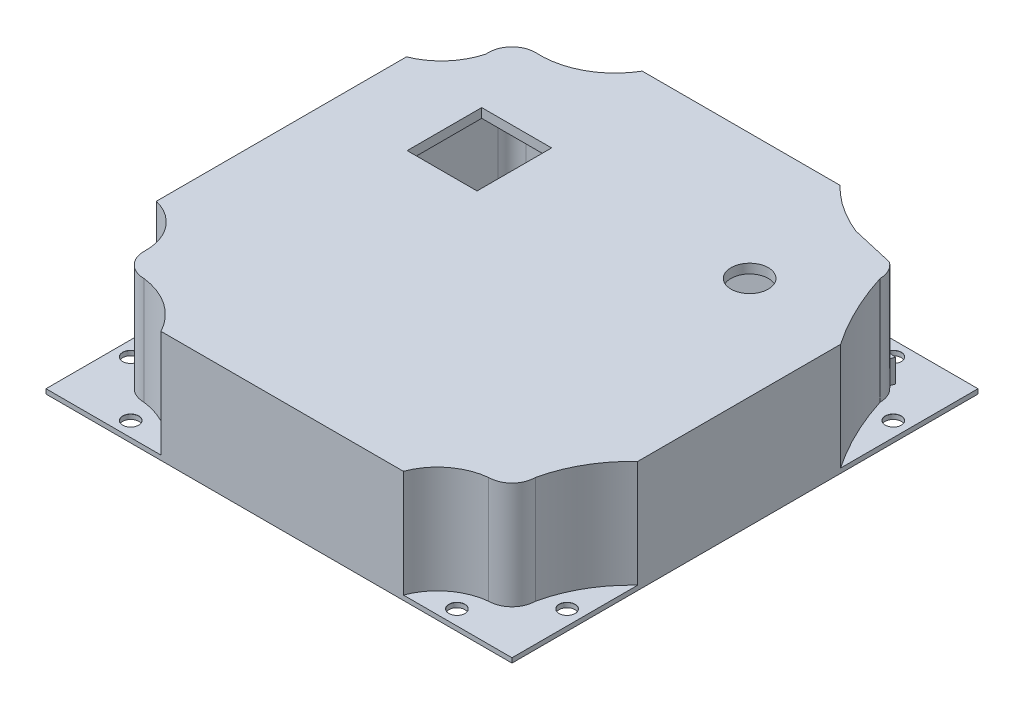
from build123d import *

# Parameters (mm, degrees)
SKETCH1_W                      = 100
SKETCH1_H                      = 100
BOSS_EXTRUDE3_DEPTH            = 6.35
M3_CLEARANCE_HOLE1_D           = 3.4
M3_CLEARANCE_HOLE1_CSINK_D     = 3.45
M3_CLEARANCE_HOLE1_CSINK_ANGLE = 90
CUT_EXTRUDE1_DEPTH             = 10
SKETCH20_R                     = 1.6
BOSS_EXTRUDE4_DEPTH            = 5
BOSS_EXTRUDE5_START            = 5
SKETCH21_W                     = 9.2
SKETCH21_H                     = 5.055773539
BOSS_EXTRUDE5_DEPTH            = 5
BOSS_EXTRUDE6_START            = 21
SKETCH21_3_W                   = 9.2
SKETCH21_3_H                   = 5.055773539
BOSS_EXTRUDE6_DEPTH            = 16
BOSS_EXTRUDE7_START            = 2
SKETCH22_R                     = 4
SKETCH22_W                     = 15
SKETCH22_H                     = 16
BOSS_EXTRUDE7_DEPTH            = 2
SKETCH24_W                     = 100
SKETCH24_H                     = 100
SKETCH24_R                     = 1.7
CUT_EXTRUDE2_DEPTH             = 5.35
CUT_EXTRUDE3_DEPTH             = 5


with BuildPart() as part:
    # Sketch1 → Boss-Extrude3 (new body)
    with BuildSketch(Plane(origin=(0, 0, 0), x_dir=(1, 0, 0), z_dir=(0, 1, 0))):
        Rectangle(SKETCH1_W, SKETCH1_H)
    extrude(amount=BOSS_EXTRUDE3_DEPTH)

    # M3 Clearance Hole1 (through all)
    with Locations(Plane(origin=(0, 6.35, 0), x_dir=(1, 0, 0), z_dir=(0, 1, 0))):
        with Locations((-46.825, 35), (-35, 46.825), (35, 46.825), (46.825, 35), (46.825, -35), (35, -46.825), (-35, -46.825), (-46.825, -35)):
            CounterSinkHole(M3_CLEARANCE_HOLE1_D / 2, M3_CLEARANCE_HOLE1_CSINK_D / 2, counter_sink_angle=M3_CLEARANCE_HOLE1_CSINK_ANGLE)

    # Sketch19 → Cut-Extrude1 (cut)
    with BuildSketch(Plane(origin=(0, 6.35, 0), x_dir=(1, 0, 0), z_dir=(0, 1, 0))):
        with BuildLine():
            Line((-37, -40), (37, -40))
            ThreePointArc((37, -40), (39.121320344, -39.121320344), (40, -37))
            Line((40, -37), (40, 37))
            ThreePointArc((40, 37), (39.121320344, 39.121320344), (37, 40))
            Line((37, 40), (-37, 40))
            ThreePointArc((-37, 40), (-39.121320344, 39.121320344), (-40, 37))
            Line((-40, 37), (-40, -37))
            ThreePointArc((-40, -37), (-39.121320344, -39.121320344), (-37, -40))
        make_face()
    extrude(amount=-CUT_EXTRUDE1_DEPTH, mode=Mode.SUBTRACT)

    # Sketch20 → Boss-Extrude4 (add)
    # profile 1 of 2: a face of its own
    with BuildSketch(Plane(origin=(0, 6.35, -6.35), x_dir=(1, 0, 0), z_dir=(0, -1, 0))):
        with BuildLine():
            Line((1.60040755, 36.488159347), (1.60040755, 46.35))
            Line((1.60040755, 46.35), (1.60040755, 51.405773539))
            Line((1.60040755, 51.405773539), (10.80040755, 51.405773539))
            Line((10.80040755, 51.405773539), (10.80040755, 46.35))
            Line((10.80040755, 46.35), (10.80040755, 36.488159347))
            ThreePointArc((10.80040755, 36.488159347), (6.20040755, 31.888159347), (1.60040755, 36.488159347))
        make_face()
        with Locations(Location((6.20040755, 36.488159347, 0), (0, 0, 90))):
            Circle(SKETCH20_R, mode=Mode.SUBTRACT)
    # profile 2 of 2: a face of its own
    with BuildSketch(Plane(origin=(0, 6.35, -6.35), x_dir=(1, 0, 0), z_dir=(0, -1, 0))):
        with BuildLine():
            Line((23.839549451, -18.252155571), (39.121320344, -32.771320344))
            Line((39.121320344, -32.771320344), (40.293422294, -35.621786908))
            Line((40.293422294, -35.621786908), (30.564708642, -36.851704553))
            Line((30.564708642, -36.851704553), (26.695067206, -33.65))
            Line((26.695067206, -33.65), (17.503754806, -24.92281552))
            ThreePointArc((17.503754806, -24.92281552), (17.335801876, -18.419094063), (23.839549451, -18.252155571))
        make_face()
        with Locations(Location((20.671131891, -21.586991424, 0), (0, 0, 90))):
            Circle(SKETCH20_R, mode=Mode.SUBTRACT)
    extrude(amount=-BOSS_EXTRUDE4_DEPTH)

    # Sketch21 → Boss-Extrude5 (add)
    with BuildSketch(Plane(origin=(0, 6.35, 0), x_dir=(1, 0, 0), z_dir=(0, 1, 0)).offset(BOSS_EXTRUDE5_START)):
        with BuildLine():
            Line((40, 37), (40, -37))
            ThreePointArc((40, -37), (39.121320344, -39.121320344), (37, -40))
            Line((37, -40), (10.80040755, -40))
            Line((10.80040755, -40), (10.80040755, -45.055773539))
            Line((10.80040755, -45.055773539), (1.60040755, -45.055773539))
            Line((1.60040755, -45.055773539), (1.60040755, -40))
            Line((1.60040755, -40), (-37, -40))
            ThreePointArc((-37, -40), (-39.121320344, -39.121320344), (-40, -37))
            Line((-40, -37), (-40, 37))
            ThreePointArc((-40, 37), (-39.121320344, 39.121320344), (-37, 40))
            Line((-37, 40), (26.695067206, 40))
            Line((26.695067206, 40), (30.564708642, 43.201704553))
            ThreePointArc((30.564708642, 43.201704553), (25.113568567, 46.068744386), (20.37225284, 50))
            Line((20.37225284, 50), (-22.050029616, 50))
            ThreePointArc((-22.050029616, 50), (-27.54753826, 44.370089204), (-35.050949086, 42))
            ThreePointArc((-35.050949086, 42), (-36.025474543, 41.970620085), (-37, 42))
            ThreePointArc((-37, 42), (-40.535533906, 40.535533906), (-42, 37))
            Line((-42, 37), (-42, 36.335199984))
            ThreePointArc((-42, 36.335199984), (-44.947236911, 30.903309262), (-50, 27.345047411))
            Line((-50, 27.345047411), (-50, -26.314925762))
            ThreePointArc((-50, -26.314925762), (-44.357013872, -29.919194986), (-42, -36.186453931))
            ThreePointArc((-42, -36.186453931), (-41.99219234, -36.593226965), (-42, -37))
            ThreePointArc((-42, -37), (-40.535533906, -40.535533906), (-37, -42))
            ThreePointArc((-37, -42), (-30.181405564, -44.566583152), (-25.327689408, -50))
            Line((-25.327689408, -50), (26.695067206, -50))
            ThreePointArc((26.695067206, -50), (30.712297628, -44.537683696), (37, -42))
            ThreePointArc((37, -42), (40.535533906, -40.535533906), (42, -37))
            ThreePointArc((42, -37), (44.938337838, -29.41034973), (50, -23.037265969))
            Line((50, -23.037265969), (50, 20.508785558))
            ThreePointArc((50, 20.508785558), (45.396228517, 28.461499137), (42, 37))
            ThreePointArc((42, 37), (41.449283771, 39.281200107), (39.918450428, 41.059882646))
            Line((39.918450428, 41.059882646), (39.121320344, 39.121320344))
            ThreePointArc((39.121320344, 39.121320344), (39.771638598, 38.148050297), (40, 37))
        make_face()
        Polygon((26.695067206, 40), (39.121320344, 39.121320344), (39.918450428, 41.059882646), (30.564708642, 43.201704553), align=None)
        with Locations((6.20040755, -42.52788677)):
            Rectangle(SKETCH21_W, SKETCH21_H)
    extrude(amount=-BOSS_EXTRUDE5_DEPTH)

    # Sketch21<3> → Boss-Extrude6 (add)
    with BuildSketch(Plane(origin=(0, 6.35, 0), x_dir=(1, 0, 0), z_dir=(0, 1, 0)).offset(BOSS_EXTRUDE6_START)):
        with BuildLine():
            Line((40, 37), (40, -37))
            ThreePointArc((40, -37), (39.121320344, -39.121320344), (37, -40))
            Line((37, -40), (10.80040755, -40))
            Line((10.80040755, -40), (10.80040755, -45.055773539))
            Line((10.80040755, -45.055773539), (1.60040755, -45.055773539))
            Line((1.60040755, -45.055773539), (1.60040755, -40))
            Line((1.60040755, -40), (-37, -40))
            ThreePointArc((-37, -40), (-39.121320344, -39.121320344), (-40, -37))
            Line((-40, -37), (-40, 37))
            ThreePointArc((-40, 37), (-39.121320344, 39.121320344), (-37, 40))
            Line((-37, 40), (26.695067206, 40))
            Line((26.695067206, 40), (30.564708642, 43.201704553))
            ThreePointArc((30.564708642, 43.201704553), (25.113568567, 46.068744386), (20.37225284, 50))
            Line((20.37225284, 50), (-22.050029616, 50))
            ThreePointArc((-22.050029616, 50), (-27.54753826, 44.370089204), (-35.050949086, 42))
            ThreePointArc((-35.050949086, 42), (-36.025474543, 41.970620085), (-37, 42))
            ThreePointArc((-37, 42), (-40.535533906, 40.535533906), (-42, 37))
            Line((-42, 37), (-42, 36.335199984))
            ThreePointArc((-42, 36.335199984), (-44.947236911, 30.903309262), (-50, 27.345047411))
            Line((-50, 27.345047411), (-50, -26.314925762))
            ThreePointArc((-50, -26.314925762), (-44.357013872, -29.919194986), (-42, -36.186453931))
            ThreePointArc((-42, -36.186453931), (-41.99219234, -36.593226965), (-42, -37))
            ThreePointArc((-42, -37), (-40.535533906, -40.535533906), (-37, -42))
            ThreePointArc((-37, -42), (-30.181405564, -44.566583152), (-25.327689408, -50))
            Line((-25.327689408, -50), (26.695067206, -50))
            ThreePointArc((26.695067206, -50), (30.712297628, -44.537683696), (37, -42))
            ThreePointArc((37, -42), (40.535533906, -40.535533906), (42, -37))
            ThreePointArc((42, -37), (44.938337838, -29.41034973), (50, -23.037265969))
            Line((50, -23.037265969), (50, 20.508785558))
            ThreePointArc((50, 20.508785558), (45.396228517, 28.461499137), (42, 37))
            ThreePointArc((42, 37), (41.449283771, 39.281200107), (39.918450428, 41.059882646))
            Line((39.918450428, 41.059882646), (39.121320344, 39.121320344))
            ThreePointArc((39.121320344, 39.121320344), (39.771638598, 38.148050297), (40, 37))
        make_face()
        Polygon((26.695067206, 40), (39.121320344, 39.121320344), (39.918450428, 41.059882646), (30.564708642, 43.201704553), align=None)
        with Locations((6.20040755, -42.52788677)):
            Rectangle(SKETCH21_3_W, SKETCH21_3_H)
    extrude(amount=-BOSS_EXTRUDE6_DEPTH)

    # Sketch22 → Boss-Extrude7 (add)
    with BuildSketch(Plane(origin=(0, 27.35, 0), x_dir=(1, 0, 0), z_dir=(0, 1, 0)).offset(BOSS_EXTRUDE7_START)):
        with BuildLine():
            Line((-42, 37), (-42, 36.335199984))
            ThreePointArc((-42, 36.335199984), (-44.947236911, 30.903309262), (-50, 27.345047411))
            Line((-50, 27.345047411), (-50, -26.314925762))
            ThreePointArc((-50, -26.314925762), (-44.106969392, -30.24013582), (-42, -37))
            ThreePointArc((-42, -37), (-40.535533906, -40.535533906), (-37, -42))
            ThreePointArc((-37, -42), (-30.181405564, -44.566583152), (-25.327689408, -50))
            Line((-25.327689408, -50), (26.695067206, -50))
            ThreePointArc((26.695067206, -50), (30.712297628, -44.537683696), (37, -42))
            ThreePointArc((37, -42), (40.535533906, -40.535533906), (42, -37))
            ThreePointArc((42, -37), (44.938337838, -29.41034973), (50, -23.037265969))
            Line((50, -23.037265969), (50, 20.508785558))
            ThreePointArc((50, 20.508785558), (45.396228517, 28.461499137), (42, 37))
            ThreePointArc((42, 37), (41.449283771, 39.281200107), (39.918450428, 41.059882646))
            Line((39.918450428, 41.059882646), (30.564708642, 43.201704553))
            ThreePointArc((30.564708642, 43.201704553), (25.113568567, 46.068744386), (20.37225284, 50))
            Line((20.37225284, 50), (-22.050029616, 50))
            ThreePointArc((-22.050029616, 50), (-28.392914241, 43.884391256), (-37, 42))
            ThreePointArc((-37, 42), (-40.535533906, 40.535533906), (-42, 37))
        make_face()
        with Locations(Location((28, 23, 0), (0, 0, 270))):
            Circle(SKETCH22_R, mode=Mode.SUBTRACT)
        with Locations((-25, 18)):
            Rectangle(SKETCH22_W, SKETCH22_H, mode=Mode.SUBTRACT)
    extrude(amount=-BOSS_EXTRUDE7_DEPTH)

    # Sketch24 → Cut-Extrude2 (cut)
    with BuildSketch(Plane.XZ):
        Rectangle(SKETCH24_W, SKETCH24_H)
        with Locations(Location((-46.825, -35, 0), (0, 0, 90))):
            Circle(SKETCH24_R, mode=Mode.SUBTRACT)
        with Locations(Location((-35, -46.825, 0), (0, 0, 90))):
            Circle(SKETCH24_R, mode=Mode.SUBTRACT)
        with Locations(Location((35, -46.825, 0), (0, 0, 90))):
            Circle(SKETCH24_R, mode=Mode.SUBTRACT)
        with Locations(Location((46.825, -35, 0), (0, 0, 90))):
            Circle(SKETCH24_R, mode=Mode.SUBTRACT)
        with Locations(Location((46.825, 35, 0), (0, 0, 90))):
            Circle(SKETCH24_R, mode=Mode.SUBTRACT)
        with Locations(Location((35, 46.825, 0), (0, 0, 90))):
            Circle(SKETCH24_R, mode=Mode.SUBTRACT)
        with Locations(Location((-35, 46.825, 0), (0, 0, 90))):
            Circle(SKETCH24_R, mode=Mode.SUBTRACT)
        with Locations(Location((-46.825, 35, 0), (0, 0, 90))):
            Circle(SKETCH24_R, mode=Mode.SUBTRACT)
        with BuildLine():
            Line((-40, 37), (-40, -37))
            ThreePointArc((-40, -37), (-39.121320344, -39.121320344), (-37, -40))
            Line((-37, -40), (37, -40))
            ThreePointArc((37, -40), (39.121320344, -39.121320344), (40, -37))
            Line((40, -37), (40, 37))
            ThreePointArc((40, 37), (39.121320344, 39.121320344), (37, 40))
            Line((37, 40), (-37, 40))
            ThreePointArc((-37, 40), (-39.121320344, 39.121320344), (-40, 37))
        make_face(mode=Mode.SUBTRACT)
    extrude(amount=-CUT_EXTRUDE2_DEPTH, mode=Mode.SUBTRACT)

    # Sketch25 → Cut-Extrude3 (cut)
    with BuildSketch(Plane.XZ.offset(-6.35)):
        with BuildLine():
            Line((10.80040755, 40), (1.60040755, 40))
            Line((1.60040755, 40), (1.60040755, 30.138159347))
            ThreePointArc((1.60040755, 30.138159347), (6.20040755, 25.538159347), (10.80040755, 30.138159347))
            Line((10.80040755, 30.138159347), (10.80040755, 40))
        make_face()
        with BuildLine():
            Line((39.121320344, -39.121320344), (23.839549451, -24.602155571))
            ThreePointArc((23.839549451, -24.602155571), (17.335801876, -24.769094063), (17.503754806, -31.27281552))
            Line((17.503754806, -31.27281552), (26.695067206, -40))
            Line((26.695067206, -40), (37, -40))
            ThreePointArc((37, -40), (38.148050297, -39.771638598), (39.121320344, -39.121320344))
        make_face()
    extrude(amount=-CUT_EXTRUDE3_DEPTH, mode=Mode.SUBTRACT)


solid = part.part
